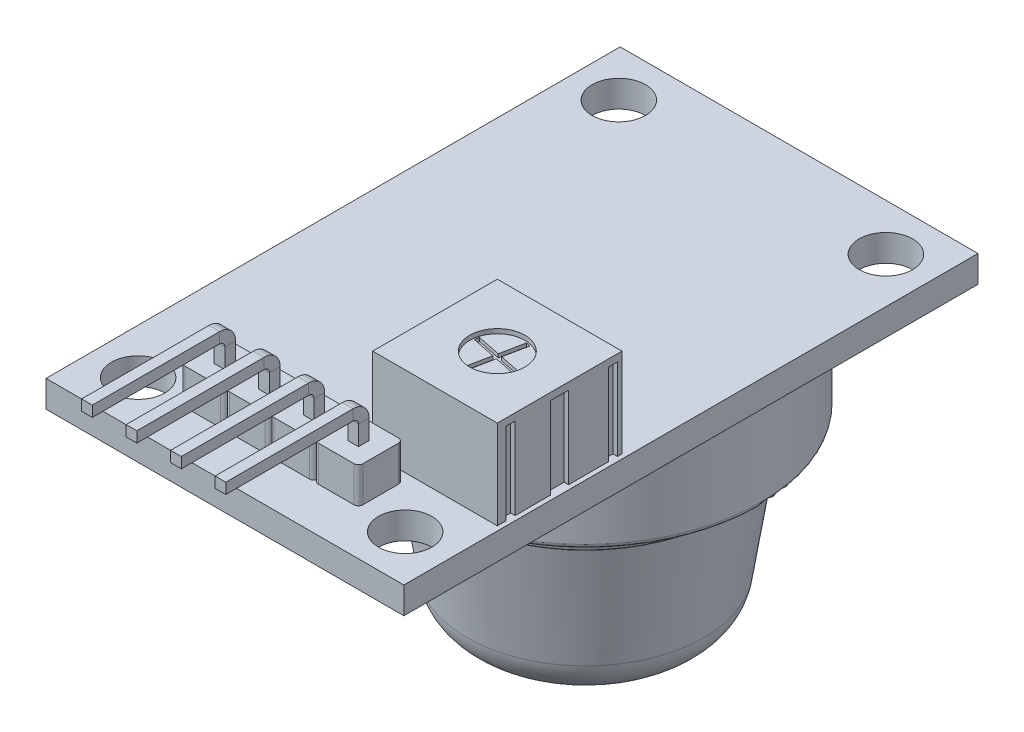
from build123d import *

# Parameters (mm, degrees)
SKETCH1_W           = 20.1
SKETCH1_H           = 32.25
SKETCH1_R           = 1.5
BOSS_EXTRUDE1_DEPTH = 1.5
SKETCH2_W           = 0.6
SKETCH2_H           = 0.6
BOSS_EXTRUDE2_DEPTH = 2
SKETCH4_W           = 0.6
SKETCH4_H           = 0.6
CUT_EXTRUDE1_DEPTH  = 1.5
SKETCH5_W           = 0.6
SKETCH5_H           = 0.6
SKETCH6_W           = 7
SKETCH6_H           = 7
BOSS_EXTRUDE3_DEPTH = 5
SKETCH7_W           = 0.5
SKETCH7_H           = 1
SKETCH7_H_2         = 0.5
CUT_EXTRUDE2_DEPTH  = 4.6
SKETCH8_R           = 1.55
CUT_EXTRUDE3_DEPTH  = 0.25
CUT_EXTRUDE4_DEPTH  = 0.2


with BuildPart() as part:
    # Sketch1 → Boss-Extrude1 (new body)
    with BuildSketch(Plane(origin=(0, 0, 0), x_dir=(1, 0, 0), z_dir=(0, 1, 0))):
        with Locations((10.05, -16.125)):
            Rectangle(SKETCH1_W, SKETCH1_H)
        with Locations(Location((2.55, -2.625, 0), (0, 0, 270))):
            Circle(SKETCH1_R, mode=Mode.SUBTRACT)
        with Locations(Location((17.55, -2.625, 0), (0, 0, 270))):
            Circle(SKETCH1_R, mode=Mode.SUBTRACT)
        with Locations(Location((2.55, -29.625, 0), (0, 0, 270))):
            Circle(SKETCH1_R, mode=Mode.SUBTRACT)
        with Locations(Location((17.55, -29.625, 0), (0, 0, 270))):
            Circle(SKETCH1_R, mode=Mode.SUBTRACT)
    extrude(amount=BOSS_EXTRUDE1_DEPTH)

    # Sketch2 → Boss-Extrude2 (add)
    with BuildSketch(Plane(origin=(0, 1.5, 0), x_dir=(1, 0, 0), z_dir=(0, 1, 0))):
        with BuildLine():
            Line((5.3, -27.25), (7.3, -27.25))
            ThreePointArc((7.3, -27.25), (7.476776695, -27.323223305), (7.55, -27.5))
            ThreePointArc((7.55, -27.5), (7.623223305, -27.323223305), (7.8, -27.25))
            Line((7.8, -27.25), (9.8, -27.25))
            ThreePointArc((9.8, -27.25), (9.976776695, -27.323223305), (10.05, -27.5))
            ThreePointArc((10.05, -27.5), (10.123223305, -27.323223305), (10.3, -27.25))
            Line((10.3, -27.25), (12.3, -27.25))
            ThreePointArc((12.3, -27.25), (12.476776695, -27.323223305), (12.55, -27.5))
            ThreePointArc((12.55, -27.5), (12.623223305, -27.323223305), (12.8, -27.25))
            Line((12.8, -27.25), (14.8, -27.25))
            ThreePointArc((14.8, -27.25), (14.976776695, -27.323223305), (15.05, -27.5))
            Line((15.05, -27.5), (15.05, -29.5))
            ThreePointArc((15.05, -29.5), (14.976776695, -29.676776695), (14.8, -29.75))
            Line((14.8, -29.75), (12.8, -29.75))
            ThreePointArc((12.8, -29.75), (12.623223305, -29.676776695), (12.55, -29.5))
            ThreePointArc((12.55, -29.5), (12.476776695, -29.676776695), (12.3, -29.75))
            Line((12.3, -29.75), (10.3, -29.75))
            ThreePointArc((10.3, -29.75), (10.123223305, -29.676776695), (10.05, -29.5))
            ThreePointArc((10.05, -29.5), (9.976776695, -29.676776695), (9.8, -29.75))
            Line((9.8, -29.75), (7.8, -29.75))
            ThreePointArc((7.8, -29.75), (7.623223305, -29.676776695), (7.55, -29.5))
            ThreePointArc((7.55, -29.5), (7.476776695, -29.676776695), (7.3, -29.75))
            Line((7.3, -29.75), (5.3, -29.75))
            ThreePointArc((5.3, -29.75), (5.123223305, -29.676776695), (5.05, -29.5))
            Line((5.05, -29.5), (5.05, -27.5))
            ThreePointArc((5.05, -27.5), (5.123223305, -27.323223305), (5.3, -27.25))
        make_face()
        with Locations((6.3, -28.5)):
            Rectangle(SKETCH2_W, SKETCH2_H, mode=Mode.SUBTRACT)
        with Locations((8.8, -28.5)):
            Rectangle(SKETCH2_W, SKETCH2_H, mode=Mode.SUBTRACT)
        with Locations((11.3, -28.5)):
            Rectangle(SKETCH2_W, SKETCH2_H, mode=Mode.SUBTRACT)
        with Locations((13.8, -28.5)):
            Rectangle(SKETCH2_W, SKETCH2_H, mode=Mode.SUBTRACT)
    extrude(amount=BOSS_EXTRUDE2_DEPTH)

    # Sketch4 → Cut-Extrude1 (cut)
    with BuildSketch(Plane(origin=(0, 1.5, 0), x_dir=(1, 0, 0), z_dir=(0, 1, 0))):
        with Locations((8.8, -28.5)):
            Rectangle(SKETCH4_W, SKETCH4_H)
        with Locations((6.3, -28.5)):
            Rectangle(SKETCH4_W, SKETCH4_H)
        with Locations((11.3, -28.5)):
            Rectangle(SKETCH4_W, SKETCH4_H)
        with Locations((13.8, -28.5)):
            Rectangle(SKETCH4_W, SKETCH4_H)
    extrude(amount=-CUT_EXTRUDE1_DEPTH, mode=Mode.SUBTRACT)

    # Sweep1: sweep along a path in Sketch3
    with BuildLine(Plane.ZY.offset(-5.05)) as sweep1_path:
        Line((28.5, -1.2), (28.5, 4.6))
        ThreePointArc((28.5, 4.6), (28.675735931, 5.024264069), (29.1, 5.2))
        Line((29.1, 5.2), (36.25, 5.2))
    # Sketch5 → Sweep1 (sweep)
    with BuildSketch(Plane(origin=(0, -1.2, 0), x_dir=(-1, 0, 0), z_dir=(0, -1, 0))):
        with Locations((-6.3, -28.5)):
            Rectangle(SKETCH5_W, SKETCH5_H)
        with Locations((-8.8, -28.5)):
            Rectangle(SKETCH5_W, SKETCH5_H)
        with Locations((-11.3, -28.5)):
            Rectangle(SKETCH5_W, SKETCH5_H)
        with Locations((-13.8, -28.5)):
            Rectangle(SKETCH5_W, SKETCH5_H)
    sweep(path=sweep1_path.line)

    # Sketch11 → Revolve1 (revolve)
    with BuildSketch(Plane(origin=(0, 0, 12), x_dir=(-1, 0, 0), z_dir=(0, 0, -1)), mode=Mode.PRIVATE) as revolve1_sk:
        with BuildLine():
            Line((-10.05, 0), (-0.5, 0))
            ThreePointArc((-0.5, 0), (-0.323223305, -0.073223305), (-0.25, -0.25))
            Line((-0.25, -0.25), (-0.25, -4.75))
            ThreePointArc((-0.25, -4.75), (-0.323223305, -4.926776695), (-0.5, -5))
            Line((-0.5, -5), (-1.838218228, -5))
            ThreePointArc((-1.838218228, -5), (-1.999811952, -5.059245004), (-2.084816709, -5.208900253))
            Line((-2.084816709, -5.208900253), (-2.293036658, -6.458219949))
            ThreePointArc((-2.293036658, -6.458219949), (-2.31003761, -6.488150999), (-2.342356354, -6.5))
            Line((-2.342356354, -6.5), (-2.4, -6.5))
            Line((-2.4, -6.5), (-3.39310828, -12.884267516))
            ThreePointArc((-3.39310828, -12.884267516), (-4.237156665, -14.398771812), (-5.863399453, -15))
            Line((-5.863399453, -15), (-10.05, -15))
            Line((-10.05, -15), (-10.05, 0))
        make_face()
    revolve(revolve1_sk.sketch.rotate(Axis((10.05, -15, 12), (0, 1, 0)), 270), axis=Axis((10.05, -15, 12), (0, 1, 0)))


with BuildPart() as body_2:
    # Sketch6 → Boss-Extrude3 (new body)
    with BuildSketch(Plane(origin=(0, 1.5, 0), x_dir=(1, 0, 0), z_dir=(0, 1, 0))):
        with Locations((16.35, -23.25)):
            Rectangle(SKETCH6_W, SKETCH6_H)
    extrude(amount=BOSS_EXTRUDE3_DEPTH)

    # Sketch7 → Cut-Extrude2 (cut)
    with BuildSketch(Plane.XZ.offset(-1.5)):
        with Locations((19.85, 23.25)):
            Rectangle(SKETCH7_W, SKETCH7_H)
        with Locations((19.85, 26)):
            Rectangle(SKETCH7_W, SKETCH7_H_2)
        with Locations((19.85, 20.25)):
            Rectangle(SKETCH7_W, SKETCH7_H_2)
    extrude(amount=-CUT_EXTRUDE2_DEPTH, mode=Mode.SUBTRACT)

    # Sketch8 → Cut-Extrude3 (cut)
    with BuildSketch(Plane(origin=(0, 6.5, 0), x_dir=(1, 0, 0), z_dir=(0, 1, 0))):
        with Locations(Location((16.35, -23.25, 0), (0, 0, 270))):
            Circle(SKETCH8_R)
    extrude(amount=-CUT_EXTRUDE3_DEPTH, mode=Mode.SUBTRACT)

    # Sketch9 → Cut-Extrude4 (cut)
    with BuildSketch(Plane(origin=(0, 6.25, 0), x_dir=(1, 0, 0), z_dir=(0, 1, 0))):
        with BuildLine():
            Line((16.52061089, -21.787346857), (16.25248865, -23.102549884))
            Line((16.25248865, -23.102549884), (14.937285624, -22.834427645))
            ThreePointArc((14.937285624, -22.834427645), (14.907108416, -22.955846691), (14.887346857, -23.07938911))
            Line((14.887346857, -23.07938911), (16.202549884, -23.34751135))
            Line((16.202549884, -23.34751135), (15.934427645, -24.662714376))
            ThreePointArc((15.934427645, -24.662714376), (16.055846691, -24.692891584), (16.17938911, -24.712653143))
            Line((16.17938911, -24.712653143), (16.44751135, -23.397450116))
            Line((16.44751135, -23.397450116), (17.762714376, -23.665572355))
            ThreePointArc((17.762714376, -23.665572355), (17.792891584, -23.544153309), (17.812653143, -23.42061089))
            Line((17.812653143, -23.42061089), (16.497450116, -23.15248865))
            Line((16.497450116, -23.15248865), (16.765572355, -21.837285624))
            ThreePointArc((16.765572355, -21.837285624), (16.644153309, -21.807108416), (16.52061089, -21.787346857))
        make_face()
    extrude(amount=-CUT_EXTRUDE4_DEPTH, mode=Mode.SUBTRACT)


solid = Compound([part.part, body_2.part])
